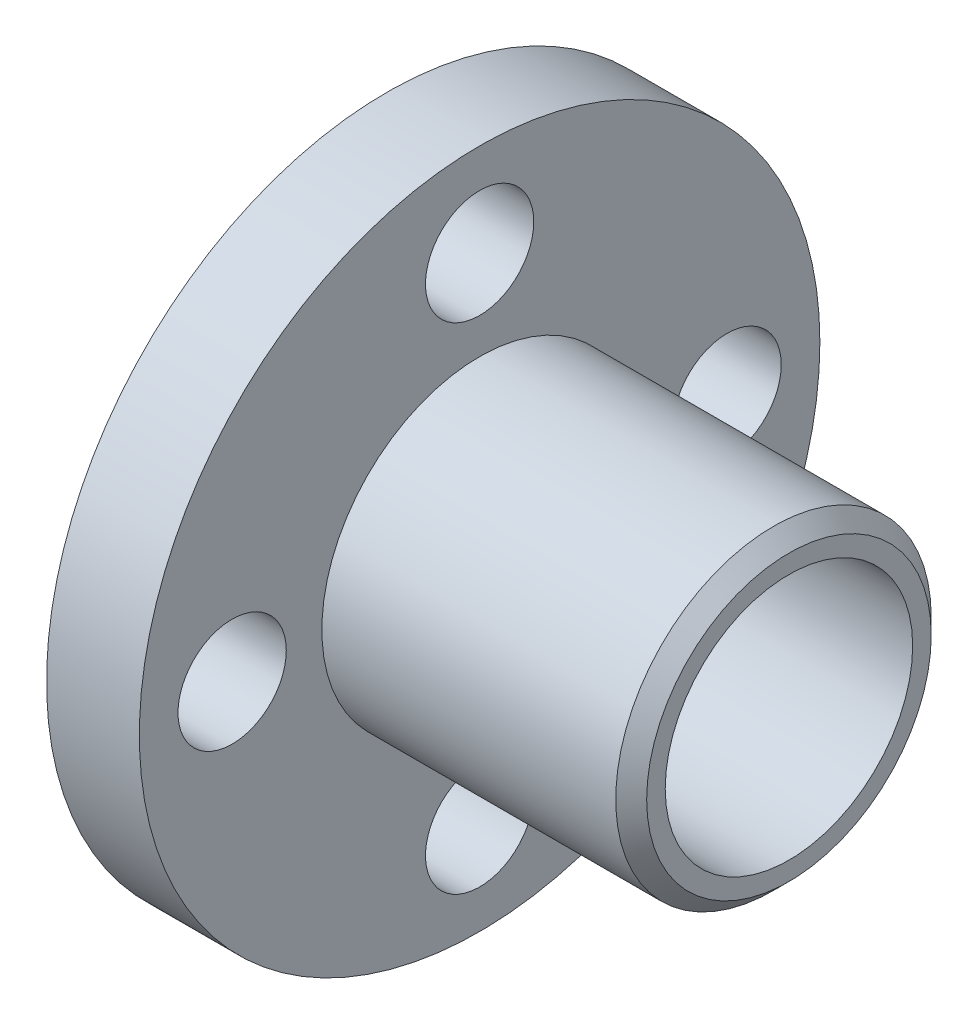
from build123d import *

# Parameters (mm, degrees)
CROQUIS1_R              = 11
CROQUIS1_R_2            = 1.75
SALIENTE_EXTRUIR1_DEPTH = 3
CROQUIS2_R              = 5.1
SALIENTE_EXTRUIR2_DEPTH = 10
CHAFL_N1_SIZE           = 0.5
SALIENTE_EXTRUIR3_START = 1.5
CROQUIS3_R              = 5.1
SALIENTE_EXTRUIR3_DEPTH = 1.5
CROQUIS4_R              = 4
CORTAR_EXTRUIR1_DEPTH   = 22.266170318


with BuildPart() as part:
    # Croquis1 → Saliente-Extruir1 (new body)
    with BuildSketch(Plane(origin=(0, 0, 0), x_dir=(0, 0, -1), z_dir=(1, 0, 0))):
        Circle(CROQUIS1_R)
        with Locations((0, 8)):
            Circle(CROQUIS1_R_2, mode=Mode.SUBTRACT)
        with Locations((8, 0)):
            Circle(CROQUIS1_R_2, mode=Mode.SUBTRACT)
        with Locations((0, -8)):
            Circle(CROQUIS1_R_2, mode=Mode.SUBTRACT)
        with Locations((-8, 0)):
            Circle(CROQUIS1_R_2, mode=Mode.SUBTRACT)
    extrude(amount=SALIENTE_EXTRUIR1_DEPTH)

    # Croquis2 → Saliente-Extruir2 (add)
    with BuildSketch(Plane(origin=(3, 0, 0), x_dir=(0, 0, -1), z_dir=(1, 0, 0))):
        Circle(CROQUIS2_R)
    extrude(amount=SALIENTE_EXTRUIR2_DEPTH)

    # Chaflán1
    chafl_n1_edges = [part.edges().sort_by_distance(p)[0] for p in [
        (13, 0, 5.1),
    ]]
    chamfer(chafl_n1_edges, length=CHAFL_N1_SIZE)

    # Croquis3 → Saliente-Extruir3 (add)
    with BuildSketch(Plane.ZY.offset(SALIENTE_EXTRUIR3_START)):
        with Locations(Location((0, 0, 0), (0, 0, 180))):
            Circle(CROQUIS3_R)
    extrude(amount=-SALIENTE_EXTRUIR3_DEPTH)

    # Croquis4 → Cortar-Extruir1 (cut, through all)
    with BuildSketch(Plane(origin=(13, 0, 0), x_dir=(0, 0, -1), z_dir=(1, 0, 0))):
        Circle(CROQUIS4_R)
    extrude(amount=-CORTAR_EXTRUIR1_DEPTH, mode=Mode.SUBTRACT)


solid = part.part
